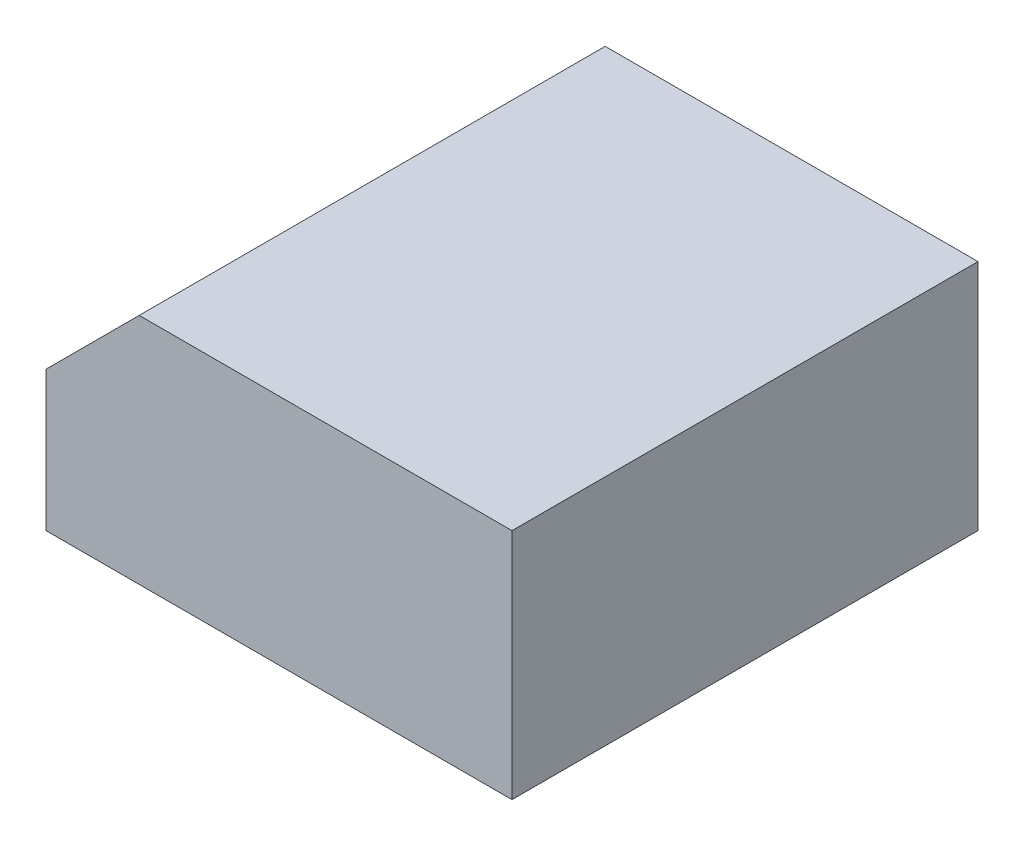
from build123d import *

# Parameters (mm, degrees)
BOSS_EXTRUDE1_DEPTH = 500
SKETCH2_W           = 750
SKETCH2_H           = 950
CUT_EXTRUDE1_DEPTH  = 480
SKETCH3_W           = 750
SKETCH3_H           = 950
BOSS_EXTRUDE2_DEPTH = 10


with BuildPart() as part:
    # Sketch1 → Boss-Extrude1 (new, symmetric)
    with BuildSketch(Plane.XY):
        Polygon((-500, 0), (500, 0), (500, 500), (-300, 500), (-500, 300), align=None)
    extrude(amount=BOSS_EXTRUDE1_DEPTH, both=True)

    # Sketch2 → Cut-Extrude1 (cut)
    with BuildSketch(Plane(origin=(0, 500, 0), x_dir=(1, 0, 0), z_dir=(0, 1, 0))):
        with Locations((100, 0)):
            Rectangle(SKETCH2_W, SKETCH2_H)
    extrude(amount=-CUT_EXTRUDE1_DEPTH, mode=Mode.SUBTRACT)

    # Sketch3 → Boss-Extrude2 (add)
    with BuildSketch(Plane(origin=(0, 500, 0), x_dir=(1, 0, 0), z_dir=(0, 1, 0))):
        with Locations((100, 0)):
            Rectangle(SKETCH3_W, SKETCH3_H)
    extrude(amount=-BOSS_EXTRUDE2_DEPTH)


solid = part.part
